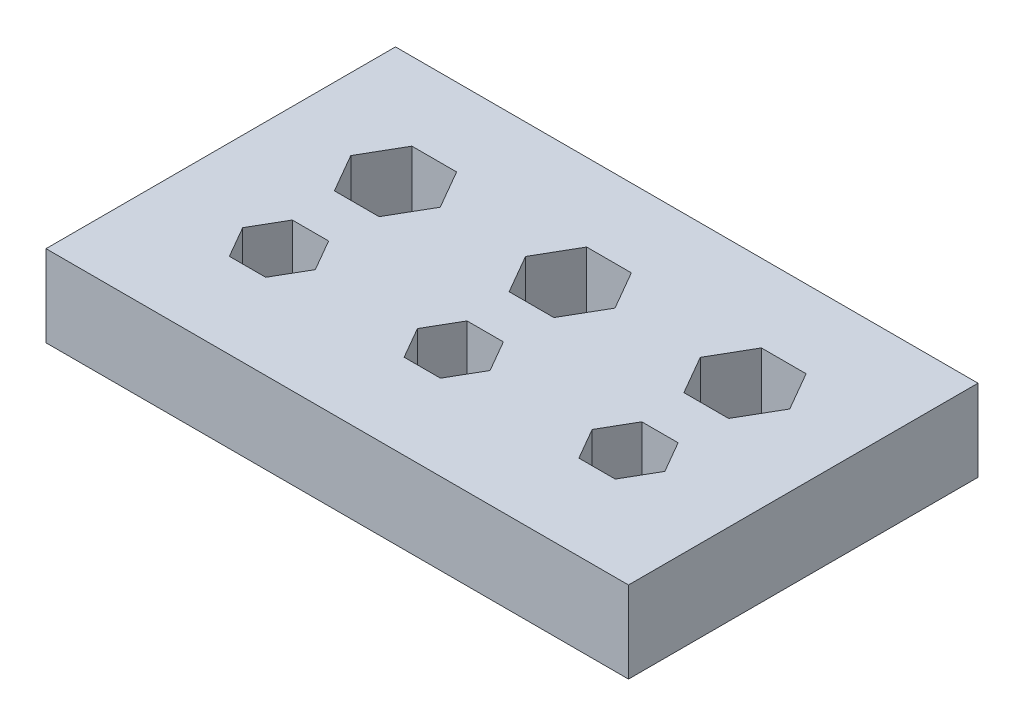
from build123d import *

# Parameters (mm, degrees)
SKETCH1_W           = 63.5
SKETCH1_H           = 38.1
BOSS_EXTRUDE1_DEPTH = 8.89
SKETCH2_R           = 2.4638
SKETCH2_R_2         = 1.5875
CUT_EXTRUDE1_DEPTH  = 7.366
SKETCH3_R           = 2.4638
SKETCH3_R_2         = 1.5875
CUT_EXTRUDE2_DEPTH  = 75.584798049


with BuildPart() as part:
    # Sketch1 → Boss-Extrude1 (new body)
    with BuildSketch(Plane(origin=(0, 0, 0), x_dir=(1, 0, 0), z_dir=(0, 1, 0))):
        with Locations((31.75, 19.05)):
            Rectangle(SKETCH1_W, SKETCH1_H)
    extrude(amount=BOSS_EXTRUDE1_DEPTH)

    # Sketch2 → Cut-Extrude1 (cut)
    # profile 1 of 6: a face of its own
    with BuildSketch(Plane(origin=(0, 8.89, 0), x_dir=(1, 0, 0), z_dir=(0, 1, 0))):
        Polygon((17.576011698, 25.4), (15.138005849, 29.62275), (10.261994151, 29.62275), (7.823988302, 25.4), (10.261994151, 21.17725), (15.138005849, 21.17725), align=None)
        with Locations(Location((12.7, 25.4, 0), (0, 0, 270))):
            Circle(SKETCH2_R, mode=Mode.SUBTRACT)
    # profile 2 of 6: a face of its own
    with BuildSketch(Plane(origin=(0, 8.89, 0), x_dir=(1, 0, 0), z_dir=(0, 1, 0))):
        Polygon((36.626011698, 25.4), (34.188005849, 29.62275), (29.311994151, 29.62275), (26.873988302, 25.4), (29.311994151, 21.17725), (34.188005849, 21.17725), align=None)
        with Locations(Location((31.75, 25.4, 0), (0, 0, 270))):
            Circle(SKETCH2_R, mode=Mode.SUBTRACT)
    # profile 3 of 6: a face of its own
    with BuildSketch(Plane(origin=(0, 8.89, 0), x_dir=(1, 0, 0), z_dir=(0, 1, 0))):
        Polygon((55.676011698, 25.4), (53.238005849, 29.62275), (48.361994151, 29.62275), (45.923988302, 25.4), (48.361994151, 21.17725), (53.238005849, 21.17725), align=None)
        with Locations(Location((50.8, 25.4, 0), (0, 0, 270))):
            Circle(SKETCH2_R, mode=Mode.SUBTRACT)
    # profile 4 of 6: a face of its own
    with BuildSketch(Plane(origin=(0, 8.89, 0), x_dir=(1, 0, 0), z_dir=(0, 1, 0))):
        Polygon((16.659468146, 12.7), (14.679734073, 16.129), (10.720265927, 16.129), (8.740531854, 12.7), (10.720265927, 9.271), (14.679734073, 9.271), align=None)
        with Locations(Location((12.7, 12.7, 0), (0, 0, 270))):
            Circle(SKETCH2_R_2, mode=Mode.SUBTRACT)
    # profile 5 of 6: a face of its own
    with BuildSketch(Plane(origin=(0, 8.89, 0), x_dir=(1, 0, 0), z_dir=(0, 1, 0))):
        Polygon((35.709468146, 12.7), (33.729734073, 16.129), (29.770265927, 16.129), (27.790531854, 12.7), (29.770265927, 9.271), (33.729734073, 9.271), align=None)
        with Locations(Location((31.75, 12.7, 0), (0, 0, 270))):
            Circle(SKETCH2_R_2, mode=Mode.SUBTRACT)
    # profile 6 of 6: a face of its own
    with BuildSketch(Plane(origin=(0, 8.89, 0), x_dir=(1, 0, 0), z_dir=(0, 1, 0))):
        Polygon((54.759468146, 12.7), (52.779734073, 16.129), (48.820265927, 16.129), (46.840531854, 12.7), (48.820265927, 9.271), (52.779734073, 9.271), align=None)
        with Locations(Location((50.8, 12.7, 0), (0, 0, 270))):
            Circle(SKETCH2_R_2, mode=Mode.SUBTRACT)
    extrude(amount=-CUT_EXTRUDE1_DEPTH, mode=Mode.SUBTRACT)

    # Sketch3 → Cut-Extrude2 (cut, through all)
    with BuildSketch(Plane(origin=(0, 8.89, 0), x_dir=(1, 0, 0), z_dir=(0, 1, 0))):
        with Locations(Location((12.7, 25.4, 0), (0, 0, 270))):
            Circle(SKETCH3_R)
        with Locations(Location((31.75, 25.4, 0), (0, 0, 270))):
            Circle(SKETCH3_R)
        with Locations(Location((50.8, 25.4, 0), (0, 0, 270))):
            Circle(SKETCH3_R)
        with Locations(Location((50.8, 12.7, 0), (0, 0, 270))):
            Circle(SKETCH3_R_2)
        with Locations(Location((31.75, 12.7, 0), (0, 0, 270))):
            Circle(SKETCH3_R_2)
        with Locations(Location((12.7, 12.7, 0), (0, 0, 270))):
            Circle(SKETCH3_R_2)
    extrude(amount=-CUT_EXTRUDE2_DEPTH, mode=Mode.SUBTRACT)


solid = part.part
